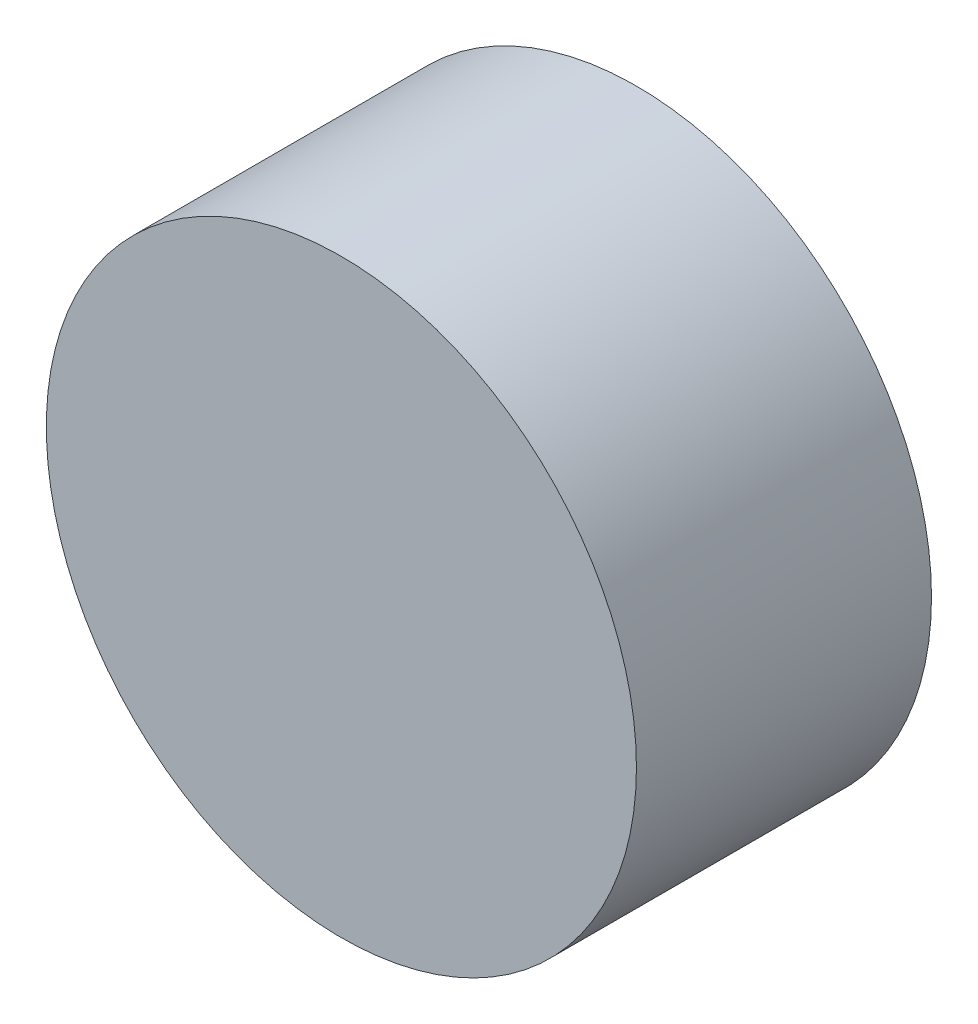
from build123d import *

# Parameters (mm, degrees)
SKETCH_1_R      = 5
EXTRUDE_1_DEPTH = 5


with BuildPart() as part:
    # 草图1 → 凸台-拉伸1 (new body)
    with BuildSketch(Plane.XY):
        Circle(SKETCH_1_R)
    extrude(amount=EXTRUDE_1_DEPTH)


solid = part.part
